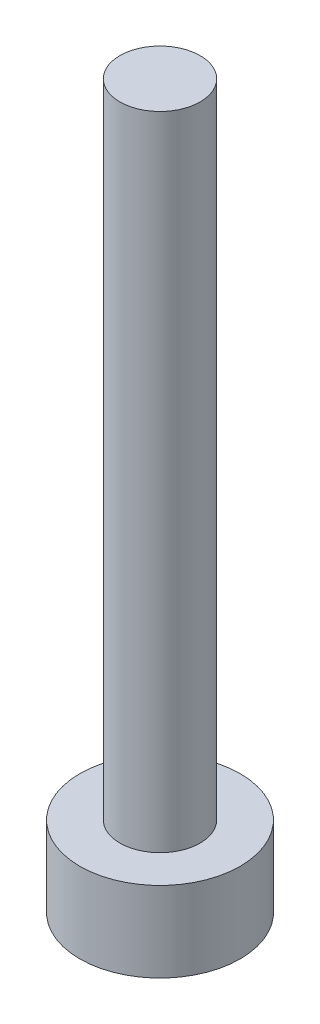
from build123d import *

# Parameters (mm, degrees)
SKETCH_1_R      = 2
EXTRUDE_1_DEPTH = 2
SKETCH_1_3_R    = 1
EXTRUDE_2_DEPTH = 16


with BuildPart() as part:
    # 草图1 → 凸台-拉伸1 (new body)
    with BuildSketch(Plane(origin=(0, 0, 0), x_dir=(1, 0, 0), z_dir=(0, 1, 0))):
        Circle(SKETCH_1_R)
    extrude(amount=-EXTRUDE_1_DEPTH)

    # 草图1<3> → 凸台-拉伸2 (add)
    with BuildSketch(Plane(origin=(0, 0, 0), x_dir=(1, 0, 0), z_dir=(0, 1, 0))):
        Circle(SKETCH_1_3_R)
    extrude(amount=EXTRUDE_2_DEPTH)


solid = part.part
